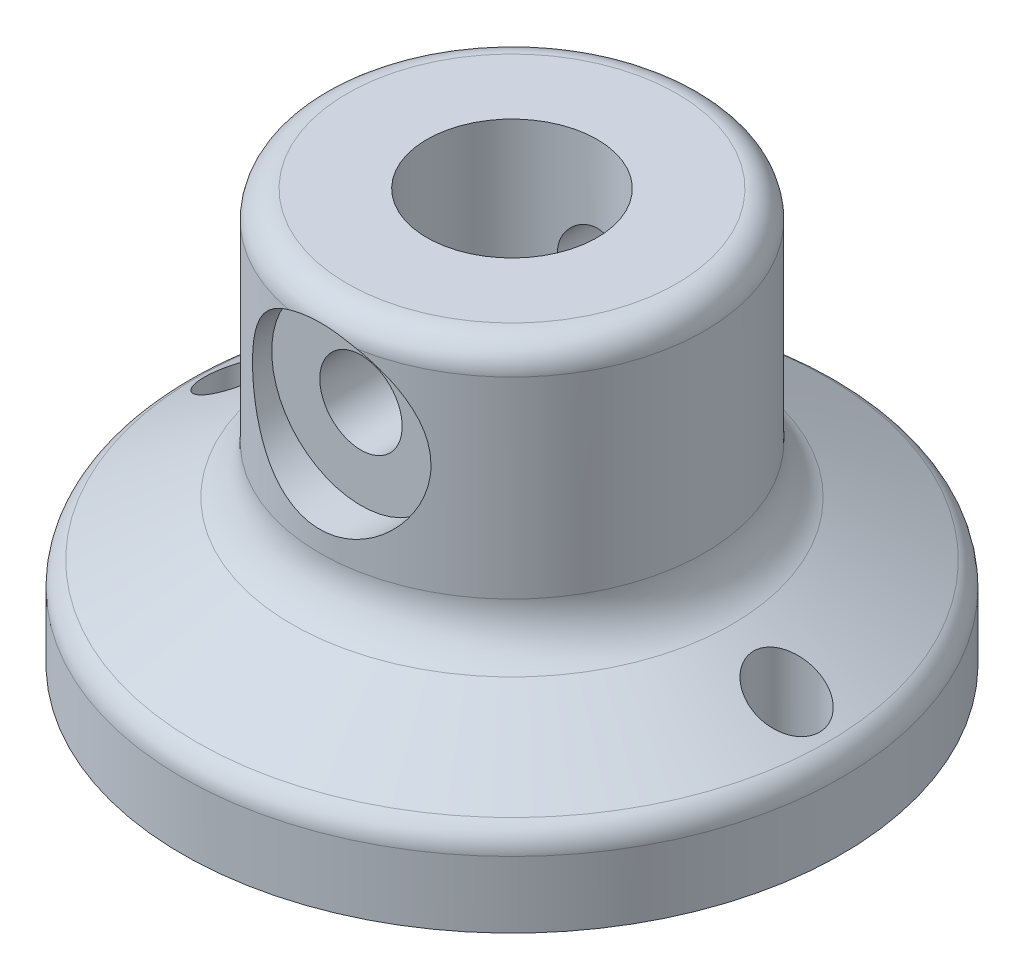
from build123d import *

# Parameters (mm, degrees)
CONG_1_R                                        = 1
ESQUISSE2_R                                     = 1.2
ENL_V_MAT_EXTRU_1_DEPTH                         = 23.649503412
CHAMBRAGE_POUR_VIS_T_TE_CYLINDRIQUE_D           = 2.4
CHAMBRAGE_POUR_VIS_T_TE_CYLINDRIQUE_CBORE_D     = 6.5
CHAMBRAGE_POUR_VIS_T_TE_CYLINDRIQUE_CBORE_DEPTH = 1.5
ESQUISSE3_R                                     = 1.5
ENL_V_MAT_EXTRU_2_DEPTH                         = 23.649503478


with BuildPart() as part:
    # Esquisse1 → Révolution1 (revolve)
    with BuildSketch(Plane.XY, mode=Mode.PRIVATE) as r_volution1_sk:
        with BuildLine():
            Line((3.1, 15), (3.1, 1))
            Line((3.1, 1), (4, 1))
            Line((4, 1), (4, 0))
            Line((4, 0), (12, 0))
            Line((12, 0), (12, 3))
            Line((12, 3), (8.013575778, 5.260181833))
            ThreePointArc((8.013575778, 5.260181833), (7.271872626, 5.993234994), (7, 7))
            Line((7, 7), (7, 15))
            Line((7, 15), (3.1, 15))
        make_face()
    revolve(r_volution1_sk.sketch.rotate(Axis((0, 0, 0), (0, 1, 0)), 90), axis=Axis((0, 0, 0), (0, 1, 0)))

    # Congé1
    cong_1_edges = [part.edges().sort_by_distance(p)[0] for p in [
        (0, 15, 7),
        (0, 3, 12),
    ]]
    fillet(cong_1_edges, radius=CONG_1_R)

    # Esquisse2 → Enlèv. mat.-Extru.1 (cut, through all)
    with BuildSketch(Plane.XZ):
        with Locations(Location((-10, 0, 0), (0, 0, 270))):
            Circle(ESQUISSE2_R)
        with Locations(Location((10, 0, 0), (0, 0, 270))):
            Circle(ESQUISSE2_R)
    extrude(amount=-ENL_V_MAT_EXTRU_1_DEPTH, mode=Mode.SUBTRACT)

    # Chambrage pour vis à tête cylindrique à 6 pans creux (ou vis CHC) M31 (through all)
    with Locations(Plane(origin=(0, 11, 7), x_dir=(1, 0, 0), z_dir=(0, 0, 1))):
        with Locations((0, 0)):
            CounterBoreHole(CHAMBRAGE_POUR_VIS_T_TE_CYLINDRIQUE_D / 2, CHAMBRAGE_POUR_VIS_T_TE_CYLINDRIQUE_CBORE_D / 2, CHAMBRAGE_POUR_VIS_T_TE_CYLINDRIQUE_CBORE_DEPTH)

    # Esquisse3 → Enlèv. mat.-Extru.2 (cut, through all)
    with BuildSketch(Plane.XY):
        with Locations(Location((0, 11, 0), (0, 0, 180))):
            Circle(ESQUISSE3_R)
    extrude(amount=ENL_V_MAT_EXTRU_2_DEPTH, mode=Mode.SUBTRACT)


solid = part.part
